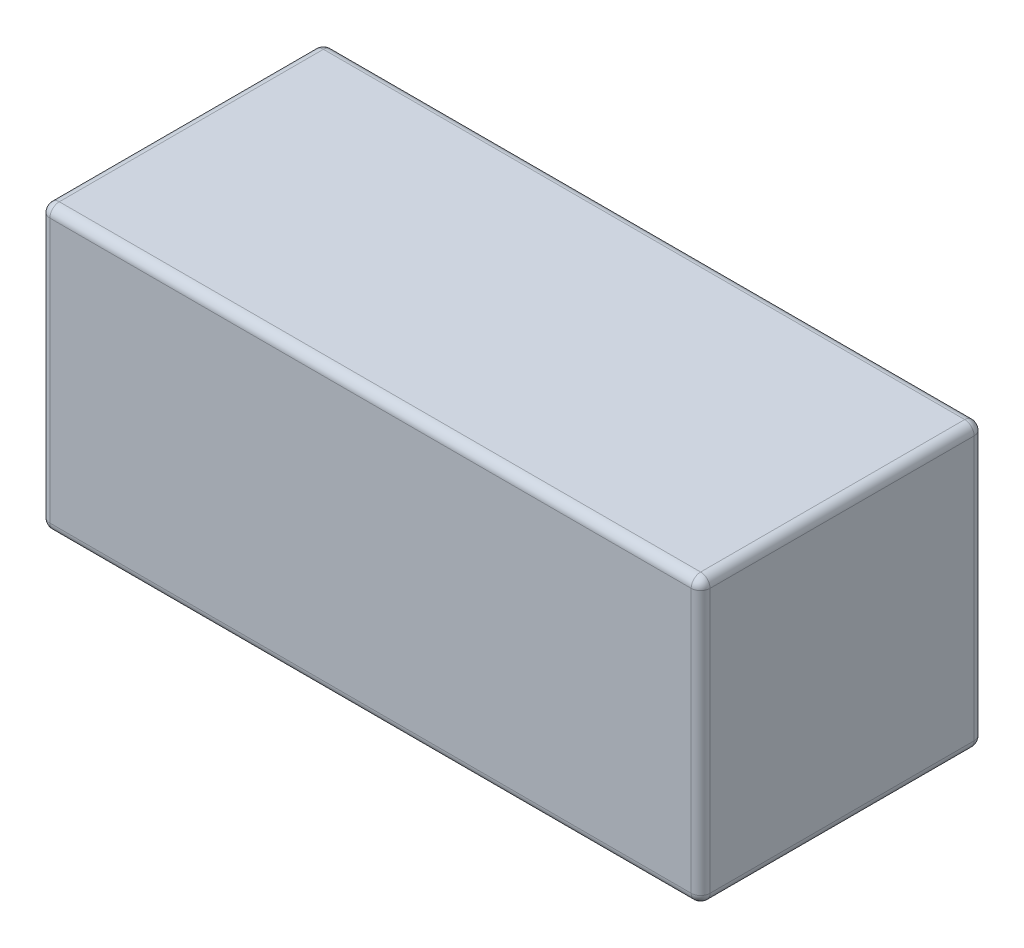
from build123d import *

# Parameters (mm, degrees)
SKETCH1_W           = 70
SKETCH1_H           = 30
BOSS_EXTRUDE1_DEPTH = 30
FILLET1_R           = 1


with BuildPart() as part:
    # Sketch1 → Boss-Extrude1 (new body)
    with BuildSketch(Plane(origin=(0, 0, 0), x_dir=(1, 0, 0), z_dir=(0, 1, 0))):
        with Locations((3.612385321, 1.376146789)):
            Rectangle(SKETCH1_W, SKETCH1_H)
    extrude(amount=BOSS_EXTRUDE1_DEPTH)

    # Fillet1
    fillet1_edges = [part.edges().sort_by_distance(p)[0] for p in [
        (38.612385321, 30, -1.376146789),
        (3.612385321, 30, -16.376146789),
        (-31.387614679, 30, -1.376146789),
        (3.612385321, 0, -16.376146789),
        (38.612385321, 0, -1.376146789),
        (3.612385321, 0, 13.623853211),
        (-31.387614679, 0, -1.376146789),
        (3.612385321, 30, 13.623853211),
        (-31.387614679, 15, -16.376146789),
        (38.612385321, 15, -16.376146789),
        (38.612385321, 15, 13.623853211),
        (-31.387614679, 15, 13.623853211),
    ]]
    fillet(fillet1_edges, radius=FILLET1_R)


solid = part.part
